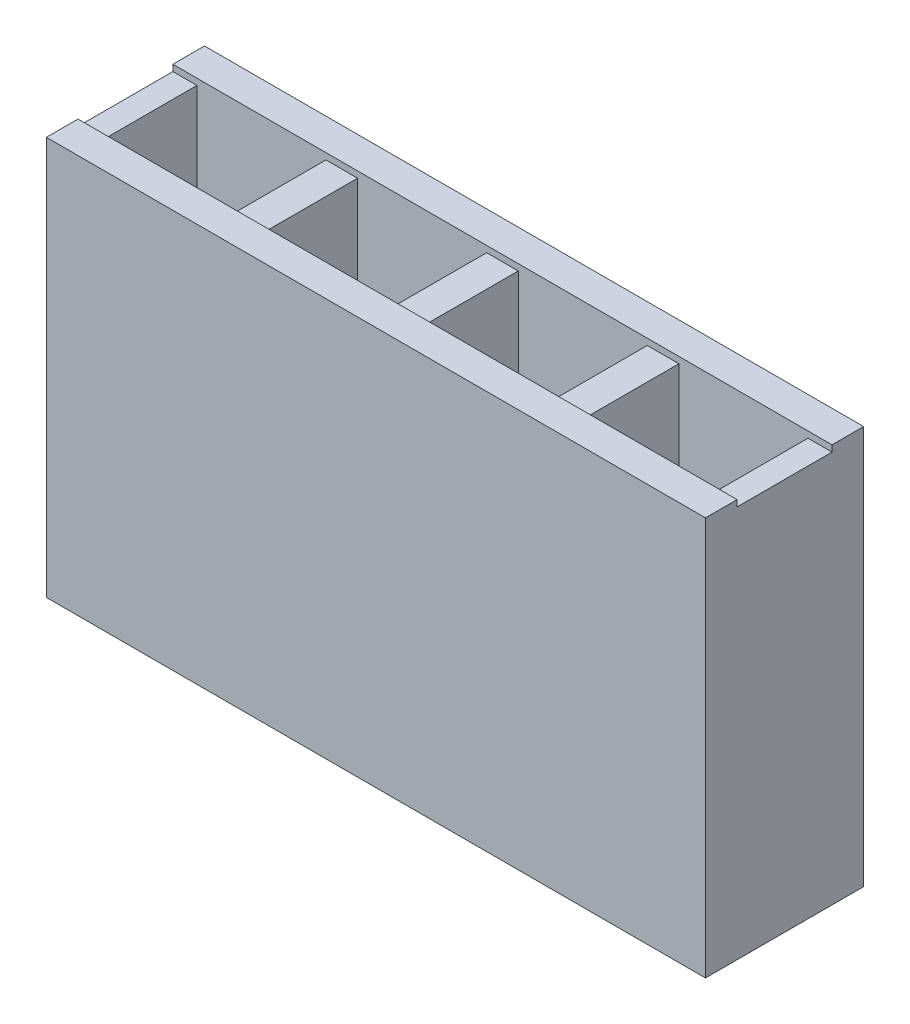
from build123d import *

# Parameters (mm, degrees)
SKETCH1_W                 = 10.42
SKETCH1_H                 = 2.5
BOSS_EXTRUDE1_DEPTH       = 6.2
SKETCH2_W                 = 2.04
SKETCH2_H                 = 1.5
CUT_EXTRUDE1_DEPTH        = 5.7
SKETCH3_W                 = 1.6
SKETCH3_H                 = 1.6
CUT_EXTRUDE2_DEPTH        = 0.5
CUT_EXTRUDE2_DRAFT        = -45
LPATTERN1_COUNT           = 4
LPATTERN1_PITCH           = 2.54
LPATTERN1_COPY_1_SKETCH_W = 1.6
LPATTERN1_COPY_1_SKETCH_H = 1.6
LPATTERN1_COPY_1_DEPTH    = 0.5
LPATTERN1_COPY_1_DRAFT    = -45
LPATTERN1_COPY_2_SKETCH_W = 1.6
LPATTERN1_COPY_2_SKETCH_H = 1.6
LPATTERN1_COPY_2_DEPTH    = 0.5
LPATTERN1_COPY_2_DRAFT    = -45
LPATTERN1_COPY_3_SKETCH_W = 1.6
LPATTERN1_COPY_3_SKETCH_H = 1.6
LPATTERN1_COPY_3_DEPTH    = 0.5
LPATTERN1_COPY_3_DRAFT    = -45
SKETCH4_W                 = 10.42
SKETCH4_H                 = 0.5
BOSS_EXTRUDE2_DEPTH       = 0.1


with BuildPart() as part:
    # Sketch1 → Boss-Extrude1 (new body)
    with BuildSketch(Plane(origin=(0, 0, 0), x_dir=(1, 0, 0), z_dir=(0, 1, 0))):
        Rectangle(SKETCH1_W, SKETCH1_H)
    extrude(amount=BOSS_EXTRUDE1_DEPTH)

    # Sketch2 → Cut-Extrude1 (cut)
    with BuildSketch(Plane(origin=(0, 6.2, 0), x_dir=(1, 0, 0), z_dir=(0, 1, 0))):
        with Locations((-3.81, 0)):
            Rectangle(SKETCH2_W, SKETCH2_H)
    cut_extrude1 = extrude(amount=-CUT_EXTRUDE1_DEPTH, mode=Mode.SUBTRACT)


with BuildPart() as cut_extrude2_tool:
    # Sketch3 → Cut-Extrude2 (with draft: the straight prism first)
    with BuildSketch(Plane.XZ):
        with Locations((-3.81, 0)):
            Rectangle(SKETCH3_W, SKETCH3_H)
    extrude(amount=-CUT_EXTRUDE2_DEPTH)
    # Cut-Extrude2: the draft: its side faces are tilted about the plane it starts from
    cut_extrude2_sides = [cut_extrude2_tool.faces().sort_by_distance(p)[0] for p in [
        (-3.81, 0.25, -0.8),
        (-3.01, 0.25, 0),
        (-3.81, 0.25, 0.8),
        (-4.61, 0.25, 0),
    ]]
    draft(cut_extrude2_sides, Plane.XZ, CUT_EXTRUDE2_DRAFT)


with BuildPart() as part_1:
    add(part.part)

    # Cut-Extrude2: cut by cut_extrude2_tool
    add(cut_extrude2_tool.part, mode=Mode.SUBTRACT)

    # LPattern1: Cut-Extrude1 ×4
    with Locations(*[(i * LPATTERN1_PITCH, 0, 0) for i in range(1, LPATTERN1_COUNT)]):
        add(cut_extrude1, mode=Mode.SUBTRACT)


with BuildPart() as lpattern1_copy_1_tool:
    # LPattern1 copy 1 sketch → LPattern1 copy 1 (with draft: the straight prism first)
    with BuildSketch(Plane(origin=(2.54, 0, 0), x_dir=(1, 0, 0), z_dir=(0, -1, 0))):
        with Locations((-3.81, 0)):
            Rectangle(LPATTERN1_COPY_1_SKETCH_W, LPATTERN1_COPY_1_SKETCH_H)
    extrude(amount=-LPATTERN1_COPY_1_DEPTH)
    # LPattern1 copy 1: the draft: its side faces are tilted about the plane it starts from
    lpattern1_copy_1_sides = [lpattern1_copy_1_tool.faces().sort_by_distance(p)[0] for p in [
        (-1.27, 0.25, -0.8),
        (-0.47, 0.25, 0),
        (-1.27, 0.25, 0.8),
        (-2.07, 0.25, 0),
    ]]
    draft(lpattern1_copy_1_sides, Plane(origin=(2.54, 0, 0), x_dir=(1, 0, 0), z_dir=(0, -1, 0)), LPATTERN1_COPY_1_DRAFT)


with BuildPart() as part_2:
    add(part_1.part)

    # LPattern1 copy 1: cut by lpattern1_copy_1_tool
    add(lpattern1_copy_1_tool.part, mode=Mode.SUBTRACT)


with BuildPart() as lpattern1_copy_2_tool:
    # LPattern1 copy 2 sketch → LPattern1 copy 2 (with draft: the straight prism first)
    with BuildSketch(Plane(origin=(5.08, 0, 0), x_dir=(1, 0, 0), z_dir=(0, -1, 0))):
        with Locations((-3.81, 0)):
            Rectangle(LPATTERN1_COPY_2_SKETCH_W, LPATTERN1_COPY_2_SKETCH_H)
    extrude(amount=-LPATTERN1_COPY_2_DEPTH)
    # LPattern1 copy 2: the draft: its side faces are tilted about the plane it starts from
    lpattern1_copy_2_sides = [lpattern1_copy_2_tool.faces().sort_by_distance(p)[0] for p in [
        (1.27, 0.25, -0.8),
        (2.07, 0.25, 0),
        (1.27, 0.25, 0.8),
        (0.47, 0.25, 0),
    ]]
    draft(lpattern1_copy_2_sides, Plane(origin=(5.08, 0, 0), x_dir=(1, 0, 0), z_dir=(0, -1, 0)), LPATTERN1_COPY_2_DRAFT)


with BuildPart() as part_3:
    add(part_2.part)

    # LPattern1 copy 2: cut by lpattern1_copy_2_tool
    add(lpattern1_copy_2_tool.part, mode=Mode.SUBTRACT)


with BuildPart() as lpattern1_copy_3_tool:
    # LPattern1 copy 3 sketch → LPattern1 copy 3 (with draft: the straight prism first)
    with BuildSketch(Plane(origin=(7.62, 0, 0), x_dir=(1, 0, 0), z_dir=(0, -1, 0))):
        with Locations((-3.81, 0)):
            Rectangle(LPATTERN1_COPY_3_SKETCH_W, LPATTERN1_COPY_3_SKETCH_H)
    extrude(amount=-LPATTERN1_COPY_3_DEPTH)
    # LPattern1 copy 3: the draft: its side faces are tilted about the plane it starts from
    lpattern1_copy_3_sides = [lpattern1_copy_3_tool.faces().sort_by_distance(p)[0] for p in [
        (3.81, 0.25, -0.8),
        (4.61, 0.25, 0),
        (3.81, 0.25, 0.8),
        (3.01, 0.25, 0),
    ]]
    draft(lpattern1_copy_3_sides, Plane(origin=(7.62, 0, 0), x_dir=(1, 0, 0), z_dir=(0, -1, 0)), LPATTERN1_COPY_3_DRAFT)


with BuildPart() as part_4:
    add(part_3.part)

    # LPattern1 copy 3: cut by lpattern1_copy_3_tool
    add(lpattern1_copy_3_tool.part, mode=Mode.SUBTRACT)

    # Sketch4 → Boss-Extrude2 (add)
    with BuildSketch(Plane(origin=(0, 6.2, 0), x_dir=(1, 0, 0), z_dir=(0, 1, 0))):
        with Locations((0, 1)):
            Rectangle(SKETCH4_W, SKETCH4_H)
    boss_extrude2 = extrude(amount=BOSS_EXTRUDE2_DEPTH)

    # Mirror1: Boss-Extrude2 across plane
    add(boss_extrude2.mirror(Plane.XY))


solid = part_4.part
